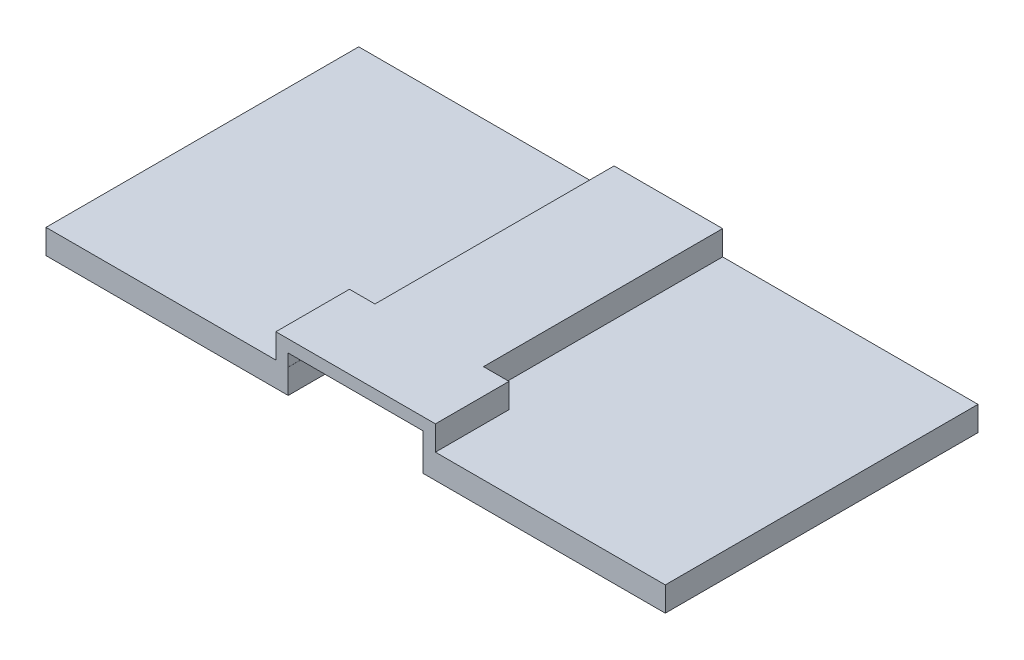
from build123d import *

# Parameters (mm, degrees)
SKETCH1_W                = 50.5
SKETCH1_H                = 25.5
BOSS_EXTRUDE1_DEPTH      = 2
SKETCH2_W                = 11
SKETCH2_H                = 5
CUT_EXTRUDE1_DEPTH       = 2
SKETCH3_W                = 8.85
SKETCH3_H                = 20.5
BOSS_EXTRUDE2_DEPTH      = 1
MOVE_FACE1_BY            = 1
SKETCH4_W                = 8.85
SKETCH4_H                = 1
BOSS_EXTRUDE3_DEPTH      = 5
BOSS_EXTRUDE4_DEPTH      = 2
BOSS_EXTRUDE4_DEPTH_BACK = 11
SKETCH5_W                = 5
SKETCH5_H                = 1
MOVE_FACE3_BY            = 0.15
MOVE_FACE4_BY            = 0.08
MOVE_FACE5_BY            = 0.08
SKETCH8_W                = 1
SKETCH8_H                = 5
BOSS_EXTRUDE5_DEPTH      = 1
SKETCH9_W                = 2.08
SKETCH9_H                = 1
BOSS_EXTRUDE6_DEPTH      = 2
SKETCH10_W               = 2.08
SKETCH10_H               = 1
BOSS_EXTRUDE7_DEPTH      = 2


with BuildPart() as part:
    # Sketch1 → Boss-Extrude1 (new body)
    with BuildSketch(Plane(origin=(0, 0, 0), x_dir=(1, 0, 0), z_dir=(0, 1, 0))):
        with Locations((6.667134831, -4.132373596)):
            Rectangle(SKETCH1_W, SKETCH1_H)
    extrude(amount=BOSS_EXTRUDE1_DEPTH)

    # Sketch2 → Cut-Extrude1 (cut)
    with BuildSketch(Plane(origin=(0, 2, 0), x_dir=(1, 0, 0), z_dir=(0, 1, 0))):
        with Locations((6.667134831, -14.382373596)):
            Rectangle(SKETCH2_W, SKETCH2_H)
    extrude(amount=-CUT_EXTRUDE1_DEPTH, mode=Mode.SUBTRACT)



with BuildPart() as body_2:
    # Sketch3 → Boss-Extrude2 (new body)
    with BuildSketch(Plane(origin=(0, 2, 0), x_dir=(1, 0, 0), z_dir=(0, 1, 0))):
        with Locations((6.667134831, -1.632373596)):
            Rectangle(SKETCH3_W, SKETCH3_H)
    extrude(amount=BOSS_EXTRUDE2_DEPTH)

    # Move Face1: a face moved outward by 1.0
    extrude(body_2.faces().sort_by_distance((6.667134831, 3, 1.632373596))[0], amount=MOVE_FACE1_BY, dir=(0, 1, 0))

    # Sketch4 → Boss-Extrude3 (add)
    with BuildSketch(Plane.XY.offset(11.882373596)):
        with Locations((6.667134831, 3.5)):
            Rectangle(SKETCH4_W, SKETCH4_H)
    extrude(amount=BOSS_EXTRUDE3_DEPTH)

    # Sketch5 → Boss-Extrude4 (add, two sides: drawn at the far end of the back side and taken through both)
    with BuildSketch(Plane.ZY.offset(-2.242134831).offset(-BOSS_EXTRUDE4_DEPTH_BACK)):
        with Locations((14.382373596, 3.5)):
            Rectangle(SKETCH5_W, SKETCH5_H)
    extrude(amount=BOSS_EXTRUDE4_DEPTH + BOSS_EXTRUDE4_DEPTH_BACK)

    # Move Face3: a face moved inward by 0.15
    extrude(body_2.faces().sort_by_distance((13.242134831, 3.5, 14.382373596))[0], amount=MOVE_FACE3_BY, dir=(-1, 0, 0), mode=Mode.SUBTRACT)

    # Move Face4: a face moved outward by 0.08
    extrude(body_2.faces().sort_by_distance((0.242134831, 3.5, 14.382373596))[0], amount=MOVE_FACE4_BY, dir=(-1, 0, 0))

    # Move Face5: a face moved outward by 0.08
    extrude(body_2.faces().sort_by_distance((13.092134831, 3.5, 14.382373596))[0], amount=MOVE_FACE5_BY, dir=(1, 0, 0))


with BuildPart() as part_1:
    add(part.part)

    add(body_2.part)  # Boss-Extrude5 merges body 2
    # Sketch8 → Boss-Extrude5 (add)
    with BuildSketch(Plane.XZ.offset(-3)):
        with Locations((0.662134831, 14.382373596)):
            Rectangle(SKETCH8_W, SKETCH8_H)
        with Locations((12.672134831, 14.382373596)):
            Rectangle(SKETCH8_W, SKETCH8_H)
    extrude(amount=BOSS_EXTRUDE5_DEPTH)

    # Sketch9 → Boss-Extrude6 (add)
    with BuildSketch(Plane(origin=(0, 2, 0), x_dir=(1, 0, 0), z_dir=(0, 1, 0))):
        with Locations((12.132134831, -11.382373596)):
            Rectangle(SKETCH9_W, SKETCH9_H)
    extrude(amount=BOSS_EXTRUDE6_DEPTH)

    # Sketch10 → Boss-Extrude7 (add)
    with BuildSketch(Plane(origin=(0, 2, 0), x_dir=(1, 0, 0), z_dir=(0, 1, 0))):
        with Locations((1.202134831, -11.382373596)):
            Rectangle(SKETCH10_W, SKETCH10_H)
    extrude(amount=BOSS_EXTRUDE7_DEPTH)


solid = part_1.part
